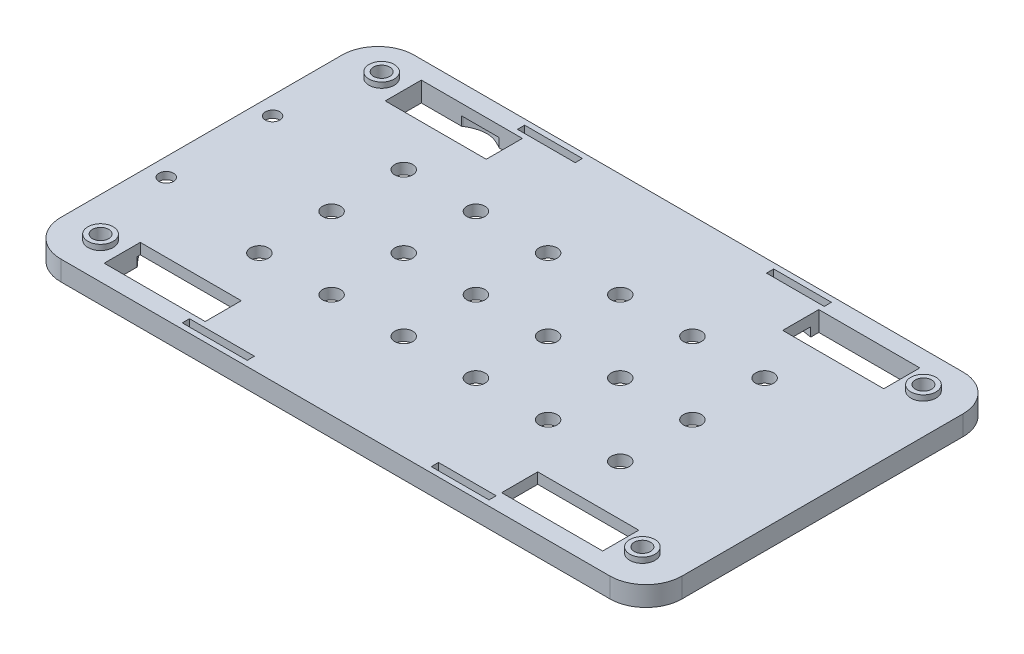
from build123d import *

# Parameters (mm, degrees)
BOSS_EXTRUDE2_DEPTH     = 6.5
CUT_EXTRUDE1_DEPTH      = 2.5
SKETCH7_W               = 15.126318285
SKETCH7_H               = 50.045217971
CUT_EXTRUDE2_DEPTH      = 2.5
SKETCH9_R               = 4.5
CUT_EXTRUDE5_DEPTH      = 3.5
SKETCH10_R              = 2.25
CUT_EXTRUDE6_DEPTH      = 21
SKETCH8_W               = 28
SKETCH8_H               = 10
CUT_EXTRUDE8_DEPTH      = 42
SKETCH8_3_W             = 12
SKETCH8_3_H             = 10
SKETCH8_3_R             = 3.5
CUT_EXTRUDE9_DEPTH      = 1
MIRROR2_COPY_1_SKETCH_R = 4.5
MIRROR2_COPY_1_DEPTH    = 3.5
MIRROR2_COPY_2_SKETCH_R = 2.25
MIRROR2_COPY_2_DEPTH    = 21
MIRROR2_COPY_3_SKETCH_W = 28
MIRROR2_COPY_3_SKETCH_H = 10
MIRROR2_COPY_3_DEPTH    = 42
MIRROR2_COPY_4_SKETCH_W = 12
MIRROR2_COPY_4_SKETCH_H = 10
MIRROR2_COPY_4_SKETCH_R = 3.5
MIRROR2_COPY_4_DEPTH    = 1
SKETCH13_W              = 122.138782423
SKETCH13_H              = 57.881417702
CUT_EXTRUDE10_DEPTH     = 1
SKETCH14_R              = 2.5
CUT_EXTRUDE11_DEPTH     = 57
SKETCH16_W              = 16
SKETCH16_H              = 2
SKETCH16_W_2            = 18
CUT_EXTRUDE12_DEPTH     = 57
SKETCH17_W              = 198.020150231
SKETCH17_H              = 122.239022266
CUT_EXTRUDE14_DEPTH     = 48.5
SKETCH23_R              = 2
CUT_EXTRUDE15_DEPTH     = 48.5
SKETCH23_3_R            = 4.25
SKETCH23_3_R_2          = 2
CUT_EXTRUDE16_DEPTH     = 1
SKETCH25_R              = 3.5
SKETCH25_R_2            = 2.25
BOSS_EXTRUDE3_DEPTH     = 1.5


with BuildPart() as part:
    # Sketch6 → Boss-Extrude2 (new body)
    with BuildSketch(Plane(origin=(0, 0, 0), x_dir=(1, 0, 0), z_dir=(0, 1, 0))):
        with BuildLine():
            Line((73.981646775, 59.583909473), (-78.157135648, 59.583909473))
            ThreePointArc((-78.157135648, 59.583909473), (-85.22820346, 56.654977285), (-88.157135648, 49.583909473))
            Line((-88.157135648, 49.583909473), (-88.157135648, -28.297508229))
            ThreePointArc((-88.157135648, -28.297508229), (-85.22820346, -35.368576041), (-78.157135648, -38.297508229))
            Line((-78.157135648, -38.297508229), (73.981646775, -38.297508229))
            ThreePointArc((73.981646775, -38.297508229), (81.052714587, -35.368576041), (83.981646775, -28.297508229))
            Line((83.981646775, -28.297508229), (83.981646775, 49.583909473))
            ThreePointArc((83.981646775, 49.583909473), (81.052714587, 56.654977285), (73.981646775, 59.583909473))
        make_face()
    extrude(amount=BOSS_EXTRUDE2_DEPTH)

    # Sketch1 → Cut-Extrude1 (cut)
    with BuildSketch(Plane(origin=(0, 0, 0), x_dir=(1, 0, 0), z_dir=(0, 1, 0))):
        with BuildLine():
            Line((77.806365081, -0.96565382), (-77.157134057, -0.96565382))
            Line((-77.157134057, -0.96565382), (-77.157133487, -14.112200011))
            add(Edge.make_bspline(
                [(-77.157133487, -14.112200011), (-77.156536942, -14.370123486), (-77.109197781, -14.873209632), (-76.835922488, -15.955912897), (-76.187889009, -17.500769448), (-75.043983016, -19.418277882), (-73.152039277, -22.009216703), (-70.349522729, -25.082160357), (-66.873619377, -28.097169115), (-63.686430755, -30.214139025), (-61.001852204, -31.406236435), (-58.827378352, -31.848010778), (-57.571800044, -31.879365283), (-56.919048161, -31.916770504)],
                knots=[0.000484301, 0.000484301, 0.000484301, 0.000484301, 0.031521334, 0.062558366, 0.124632431, 0.186706496, 0.248780561, 0.37292869, 0.49707682, 0.62122495, 0.745373079, 0.869521209, 0.993669339, 0.993669339, 0.993669339, 0.993669339], degree=3))
            add(Edge.make_bspline(
                [(-56.919048161, -31.916770504), (-56.676855651, -31.887329504), (-56.202107187, -31.827411173), (-55.17909933, -31.687000892), (-53.829380758, -31.487736495), (-52.075898695, -31.218386946), (-49.57440565, -30.835368063), (-46.14645809, -30.337211074), (-41.582465958, -29.781294531), (-36.59758114, -29.326101352), (-29.427370913, -28.913030471), (-19.557102597, -28.846779859), (-6.483877393, -29.587535165), (5.244808229, -30.786505775), (15.023020088, -31.929485511), (22.521025078, -32.809036887), (30.153844065, -33.641998773), (35.340846207, -34.107490241), (37.926285135, -34.298975741)],
                knots=[0.000538145, 0.000538145, 0.000538145, 0.000538145, 0.016151963, 0.031765781, 0.062993416, 0.094221052, 0.125448688, 0.18790396, 0.250359232, 0.312814503, 0.375269775, 0.500180319, 0.625090862, 0.750001406, 0.812456678, 0.874911949, 0.937367221, 0.999822493, 0.999822493, 0.999822493, 0.999822493], degree=3))
            ThreePointArc((37.926285135, -34.298975741), (38.702526051, -34.294429262), (39.475271872, -34.220710033))
            add(Edge.make_bspline(
                [(39.475271872, -34.220710033), (41.007855914, -34.057436076), (44.089984585, -33.714701696), (50.083540013, -32.842915348), (57.096899249, -31.185924421), (64.218389099, -27.883874428), (69.776327895, -23.185685517), (73.049743993, -18.278857828), (74.917700916, -14.026885359), (75.980532113, -10.773207259), (76.750872111, -7.572378035), (77.199527425, -5.064024493), (77.479780782, -3.227934), (77.653952405, -2.012317888), (77.758523252, -1.282417326), (77.806365081, -0.96565382)],
                knots=[-0.000308659, -0.000308659, -0.000308659, -0.000308659, 0.063093373, 0.126495404, 0.253299468, 0.380103532, 0.506907596, 0.633711659, 0.697113691, 0.760515723, 0.823917755, 0.887319787, 0.919020803, 0.950721818, 0.978851886, 0.978851886, 0.978851886, 0.978851886], degree=3))
        make_face()
        with BuildLine():
            Line((-77.157135648, 35.76464303), (-77.157134057, -0.96565382))
            Line((-77.157134057, -0.96565382), (77.806365081, -0.96565382))
            add(Edge.make_bspline(
                [(77.806365081, -0.96565382), (77.812438323, -0.925442533), (77.87221605, -0.53245946), (77.930059012, -0.183407073), (77.984899751, 0.147711222)],
                knots=[0.978851886, 0.978851886, 0.978851886, 0.978851886, 0.982422834, 1.01412385, 1.01412385, 1.01412385, 1.01412385], degree=3))
            add(Edge.make_bspline(
                [(77.984899751, 0.147711222), (78.028632075, 1.263321996), (78.063685274, 3.522430751), (77.942610131, 6.756968322), (77.659550444, 9.90467033), (77.073307047, 13.967118446), (75.962568899, 18.783585703), (73.443316656, 25.935742417), (69.020568834, 33.80984715), (62.049489108, 41.493231365), (53.789484117, 47.344418041), (44.612113932, 51.294661515), (34.903628635, 53.280392725), (28.311253849, 53.235690332), (25.060177828, 52.873239487)],
                knots=[0.000169226, 0.000169226, 0.000169226, 0.000169226, 0.031413574, 0.062657922, 0.09390227, 0.125146618, 0.187635314, 0.25012401, 0.375101401, 0.500078793, 0.625056185, 0.750033577, 0.875010969, 0.999988361, 0.999988361, 0.999988361, 0.999988361], degree=3))
            add(Edge.make_bspline(
                [(25.060177828, 52.873239487), (19.895446944, 51.629390577), (12.322434608, 49.13169364), (2.160698602, 45.971278142), (-3.037110446, 44.691336857), (-5.659268145, 44.190364293)],
                knots=[0.000658959, 0.000658959, 0.000658959, 0.000658959, 0.498067368, 0.746771573, 0.995475778, 0.995475778, 0.995475778, 0.995475778], degree=3))
            add(Edge.make_bspline(
                [(-5.659268145, 44.190364293), (-6.687899132, 44.046149587), (-8.728734339, 43.771857825), (-12.963271971, 43.266800577), (-18.182613839, 42.795189919), (-23.901458121, 42.63215561), (-28.830638135, 42.989857068), (-32.966568973, 43.951399156), (-35.917714049, 45.291439085), (-38.19591431, 46.677930402), (-39.939161114, 47.865789175), (-41.506959745, 48.979842665), (-42.863802202, 49.929184347), (-43.616290768, 50.440510486), (-43.98532936, 50.688555671)],
                knots=[-0.00019559, -0.00019559, -0.00019559, -0.00019559, 0.062587211, 0.125370012, 0.250935613, 0.376501215, 0.502066816, 0.627632417, 0.753198019, 0.81598082, 0.87876362, 0.941546421, 0.972937821, 1.004329222, 1.004329222, 1.004329222, 1.004329222], degree=3))
            add(Edge.make_bspline(
                [(-43.98532936, 50.688555671), (-44.244485854, 50.867312015), (-44.768150418, 51.232519494), (-45.750657054, 51.933111662), (-46.891239492, 52.75905139), (-48.145972585, 53.649626958), (-49.697116091, 54.681113287), (-51.460780236, 55.648746777), (-53.407719169, 56.259273829), (-55.251731489, 56.357375065), (-56.710973324, 56.08081223), (-57.794758617, 55.713765742), (-58.546542767, 55.391458897), (-59.229896481, 55.042763399), (-59.583745645, 54.835934013), (-59.770155285, 54.723823826)],
                knots=[-0.002497219, -0.002497219, -0.002497219, -0.002497219, 0.029065652, 0.060628523, 0.123754265, 0.186880007, 0.250005749, 0.376257234, 0.502508718, 0.628760202, 0.755011687, 0.818137429, 0.881263171, 0.944388913, 1.007514655, 1.007514655, 1.007514655, 1.007514655], degree=3))
            add(Edge.make_bspline(
                [(-59.770155285, 54.723823826), (-60.193626174, 54.476092852), (-61.03864602, 53.961192652), (-62.636768194, 52.907176262), (-65.258656407, 50.976312285), (-68.51709364, 48.049765778), (-71.244275363, 45.065662035), (-73.189921829, 42.724657875), (-74.069794154, 41.617885903), (-74.515784144, 41.052117052)],
                knots=[0.000174078, 0.000174078, 0.000174078, 0.000174078, 0.062881444, 0.12558881, 0.251003541, 0.501833004, 0.752662466, 0.878077198, 1.003491929, 1.003491929, 1.003491929, 1.003491929], degree=3))
            add(Edge.make_bspline(
                [(-74.515784144, 41.052117052), (-75.065753244, 40.22169422), (-76.07645723, 38.477870595), (-76.833603448, 36.687528936), (-77.157135648, 35.76464303)],
                knots=[0.499549048, 0.499549048, 0.499549048, 0.499549048, 0.499765799, 0.49998255, 0.49998255, 0.49998255, 0.49998255], degree=3))
        make_face()
    extrude(amount=CUT_EXTRUDE1_DEPTH, mode=Mode.SUBTRACT)

    # Sketch7 → Cut-Extrude2 (cut)
    with BuildSketch(Plane.XZ):
        with Locations((-83.782077592, -10.91040897)):
            Rectangle(SKETCH7_W, SKETCH7_H)
    extrude(amount=-CUT_EXTRUDE2_DEPTH, mode=Mode.SUBTRACT)

    # Sketch9 → Cut-Extrude5 (cut)
    with BuildSketch(Plane.XZ):
        with Locations(Location((72.981646775, -49.583909473, 0), (0, 0, 270))):
            Circle(SKETCH9_R)
    cut_extrude5 = extrude(amount=-CUT_EXTRUDE5_DEPTH, mode=Mode.SUBTRACT)

    # Sketch10 → Cut-Extrude6 (cut)
    with BuildSketch(Plane.XZ.offset(-3.5)):
        with Locations(Location((72.981646775, -49.583909473, 0), (0, 0, 270))):
            Circle(SKETCH10_R)
    cut_extrude6 = extrude(amount=-CUT_EXTRUDE6_DEPTH, mode=Mode.SUBTRACT)

    # Sketch8 → Cut-Extrude8 (cut)
    with BuildSketch(Plane(origin=(0, 6.5, 0), x_dir=(1, 0, 0), z_dir=(0, 1, 0))):
        with Locations((52.981646775, 49.583909473)):
            Rectangle(SKETCH8_W, SKETCH8_H)
    cut_extrude8 = extrude(amount=-CUT_EXTRUDE8_DEPTH, mode=Mode.SUBTRACT)

    # Sketch8<3> → Cut-Extrude9 (cut)
    with BuildSketch(Plane(origin=(0, 6.5, 0), x_dir=(1, 0, 0), z_dir=(0, 1, 0))):
        with Locations((72.981646775, 49.583909473)):
            Rectangle(SKETCH8_3_W, SKETCH8_3_H)
        with Locations(Location((72.981646775, 49.583909473, 0), (0, 0, 270))):
            Circle(SKETCH8_3_R, mode=Mode.SUBTRACT)
    cut_extrude9 = extrude(amount=-CUT_EXTRUDE9_DEPTH, mode=Mode.SUBTRACT)

    # Mirror1: Cut-Extrude5, Cut-Extrude6, Cut-Extrude8, Cut-Extrude9 across plane
    add(cut_extrude5.mirror(Plane.XY.offset(-10.643200622)), mode=Mode.SUBTRACT)
    add(cut_extrude6.mirror(Plane.XY.offset(-10.643200622)), mode=Mode.SUBTRACT)
    add(cut_extrude8.mirror(Plane.XY.offset(-10.643200622)), mode=Mode.SUBTRACT)
    add(cut_extrude9.mirror(Plane.XY.offset(-10.643200622)), mode=Mode.SUBTRACT)

    # Mirror2: Cut-Extrude5, Cut-Extrude6, Cut-Extrude8, Cut-Extrude9 across plane
    add(cut_extrude5.mirror(Plane.ZY.offset(2.087744437)), mode=Mode.SUBTRACT)
    add(cut_extrude6.mirror(Plane.ZY.offset(2.087744437)), mode=Mode.SUBTRACT)
    add(cut_extrude8.mirror(Plane.ZY.offset(2.087744437)), mode=Mode.SUBTRACT)
    add(cut_extrude9.mirror(Plane.ZY.offset(2.087744437)), mode=Mode.SUBTRACT)

    # Mirror2 copy 1 sketch → Mirror2 copy 1 (cut)
    with BuildSketch(Plane(origin=(-4.175488873, 0, -21.286401244), x_dir=(-1, 0, 0), z_dir=(0, -1, 0))):
        with Locations(Location((72.981646775, -49.583909473, 0), (0, 0, 270))):
            Circle(MIRROR2_COPY_1_SKETCH_R)
    extrude(amount=-MIRROR2_COPY_1_DEPTH, mode=Mode.SUBTRACT)

    # Mirror2 copy 2 sketch → Mirror2 copy 2 (cut)
    with BuildSketch(Plane(origin=(-4.175488873, 3.5, -21.286401244), x_dir=(-1, 0, 0), z_dir=(0, -1, 0))):
        with Locations(Location((72.981646775, -49.583909473, 0), (0, 0, 270))):
            Circle(MIRROR2_COPY_2_SKETCH_R)
    extrude(amount=-MIRROR2_COPY_2_DEPTH, mode=Mode.SUBTRACT)

    # Mirror2 copy 3 sketch → Mirror2 copy 3 (cut)
    with BuildSketch(Plane(origin=(-4.175488873, 6.5, -21.286401244), x_dir=(-1, 0, 0), z_dir=(0, 1, 0))):
        with Locations((52.981646775, 49.583909473)):
            Rectangle(MIRROR2_COPY_3_SKETCH_W, MIRROR2_COPY_3_SKETCH_H)
    extrude(amount=-MIRROR2_COPY_3_DEPTH, mode=Mode.SUBTRACT)

    # Mirror2 copy 4 sketch → Mirror2 copy 4 (cut)
    with BuildSketch(Plane(origin=(-4.175488873, 6.5, -21.286401244), x_dir=(-1, 0, 0), z_dir=(0, 1, 0))):
        with Locations((72.981646775, 49.583909473)):
            Rectangle(MIRROR2_COPY_4_SKETCH_W, MIRROR2_COPY_4_SKETCH_H)
        with Locations(Location((72.981646775, 49.583909473, 0), (0, 0, 270))):
            Circle(MIRROR2_COPY_4_SKETCH_R, mode=Mode.SUBTRACT)
    extrude(amount=-MIRROR2_COPY_4_DEPTH, mode=Mode.SUBTRACT)

    # Sketch13 → Cut-Extrude10 (cut)
    with BuildSketch(Plane(origin=(0, 6.5, 0), x_dir=(1, 0, 0), z_dir=(0, 1, 0))):
        with Locations((-2.087744436, 10.643200622)):
            Rectangle(SKETCH13_W, SKETCH13_H)
    extrude(amount=-CUT_EXTRUDE10_DEPTH, mode=Mode.SUBTRACT)

    # Sketch14 → Cut-Extrude11 (cut)
    with BuildSketch(Plane(origin=(0, 5.5, 0), x_dir=(1, 0, 0), z_dir=(0, 1, 0))):
        with Locations(Location((-52.087744437, 30.643200622, 0), (0, 0, 270))):
            Circle(SKETCH14_R)
        with Locations(Location((7.912255563, 30.643200622, 0), (0, 0, 270))):
            Circle(SKETCH14_R)
        with Locations(Location((27.912255563, 30.643200622, 0), (0, 0, 270))):
            Circle(SKETCH14_R)
        with Locations(Location((47.912255563, 30.643200622, 0), (0, 0, 270))):
            Circle(SKETCH14_R)
        with Locations(Location((47.912255563, 10.643200622, 0), (0, 0, 270))):
            Circle(SKETCH14_R)
        with Locations(Location((7.912255563, 10.643200622, 0), (0, 0, 270))):
            Circle(SKETCH14_R)
        with Locations(Location((-12.087744437, 10.643200622, 0), (0, 0, 270))):
            Circle(SKETCH14_R)
        with Locations(Location((-32.087744437, 10.643200622, 0), (0, 0, 270))):
            Circle(SKETCH14_R)
        with Locations(Location((-52.087744437, 10.643200622, 0), (0, 0, 270))):
            Circle(SKETCH14_R)
        with Locations(Location((47.912255563, -9.356799378, 0), (0, 0, 270))):
            Circle(SKETCH14_R)
        with Locations(Location((27.912255563, -9.356799378, 0), (0, 0, 270))):
            Circle(SKETCH14_R)
        with Locations(Location((7.912255563, -9.356799378, 0), (0, 0, 270))):
            Circle(SKETCH14_R)
        with Locations(Location((-12.087744437, -9.356799378, 0), (0, 0, 270))):
            Circle(SKETCH14_R)
        with Locations(Location((-32.087744437, -9.356799378, 0), (0, 0, 270))):
            Circle(SKETCH14_R)
        with Locations(Location((-52.087744437, -9.356799378, 0), (0, 0, 270))):
            Circle(SKETCH14_R)
        with Locations(Location((-32.087744437, 30.643200622, 0), (0, 0, 270))):
            Circle(SKETCH14_R)
        with Locations(Location((-12.087744437, 30.643200622, 0), (0, 0, 270))):
            Circle(SKETCH14_R)
        with Locations(Location((27.912255563, 10.643200622, 0), (0, 0, 270))):
            Circle(SKETCH14_R)
    extrude(amount=-CUT_EXTRUDE11_DEPTH, mode=Mode.SUBTRACT)

    # Sketch16 → Cut-Extrude12 (cut)
    with BuildSketch(Plane.XZ):
        with Locations((30.981646775, -57.083909473)):
            Rectangle(SKETCH16_W, SKETCH16_H)
        with Locations((30.981646775, 35.797508229)):
            Rectangle(SKETCH16_W, SKETCH16_H)
        with Locations((-38.018353225, -57.083909473)):
            Rectangle(SKETCH16_W, SKETCH16_H)
        with Locations((-37.018353225, 35.797508229)):
            Rectangle(SKETCH16_W_2, SKETCH16_H)
    extrude(amount=-CUT_EXTRUDE12_DEPTH, mode=Mode.SUBTRACT)

    # Sketch17 → Cut-Extrude14 (cut)
    with BuildSketch(Plane(origin=(0, 5.5, 0), x_dir=(1, 0, 0), z_dir=(0, 1, 0))):
        with Locations((-0.586253557, 7.90518784)):
            Rectangle(SKETCH17_W, SKETCH17_H)
    extrude(amount=CUT_EXTRUDE14_DEPTH, mode=Mode.SUBTRACT)

    # Sketch23 → Cut-Extrude15 (cut)
    with BuildSketch(Plane.XZ.offset(-2.5)):
        with Locations(Location((-83.157135648, 4.08959103, 0), (0, 0, 270))):
            Circle(SKETCH23_R)
    cut_extrude15 = extrude(amount=-CUT_EXTRUDE15_DEPTH, mode=Mode.SUBTRACT)

    # Sketch23<3> → Cut-Extrude16 (cut)
    with BuildSketch(Plane.XZ.offset(-2.5)):
        with Locations(Location((-83.157135648, 4.08959103, 0), (0, 0, 270))):
            Circle(SKETCH23_3_R)
        with Locations(Location((-83.157135648, 4.08959103, 0), (0, 0, 270))):
            Circle(SKETCH23_3_R_2, mode=Mode.SUBTRACT)
    cut_extrude16 = extrude(amount=-CUT_EXTRUDE16_DEPTH, mode=Mode.SUBTRACT)

    # Mirror4: Cut-Extrude15, Cut-Extrude16 across plane
    add(cut_extrude15.mirror(Plane.XY.offset(-10.643200622)), mode=Mode.SUBTRACT)
    add(cut_extrude16.mirror(Plane.XY.offset(-10.643200622)), mode=Mode.SUBTRACT)

    # Sketch25 → Boss-Extrude3 (add)
    # profile 1 of 4: a face of its own
    with BuildSketch(Plane(origin=(0, 5.5, 0), x_dir=(1, 0, 0), z_dir=(0, 1, 0))):
        with Locations(Location((72.981646775, 49.583909473, 0), (0, 0, 270))):
            Circle(SKETCH25_R)
        with Locations(Location((72.981646775, 49.583909473, 0), (0, 0, 90))):
            Circle(SKETCH25_R_2, mode=Mode.SUBTRACT)
    # profile 2 of 4: a face of its own
    with BuildSketch(Plane(origin=(0, 5.5, 0), x_dir=(1, 0, 0), z_dir=(0, 1, 0))):
        with Locations(Location((72.981646775, -28.297508229, 0), (0, 0, 270))):
            Circle(SKETCH25_R)
        with Locations(Location((72.981646775, -28.297508229, 0), (0, 0, 270))):
            Circle(SKETCH25_R_2, mode=Mode.SUBTRACT)
    # profile 3 of 4: a face of its own
    with BuildSketch(Plane(origin=(0, 5.5, 0), x_dir=(1, 0, 0), z_dir=(0, 1, 0))):
        with Locations(Location((-77.157135648, 49.583909473, 0), (0, 0, 270))):
            Circle(SKETCH25_R)
        with Locations(Location((-77.157135648, 49.583909473, 0), (0, 0, 90))):
            Circle(SKETCH25_R_2, mode=Mode.SUBTRACT)
    # profile 4 of 4: a face of its own
    with BuildSketch(Plane(origin=(0, 5.5, 0), x_dir=(1, 0, 0), z_dir=(0, 1, 0))):
        with Locations(Location((-77.157135648, -28.297508229, 0), (0, 0, 270))):
            Circle(SKETCH25_R)
        with Locations(Location((-77.157135648, -28.297508229, 0), (0, 0, 270))):
            Circle(SKETCH25_R_2, mode=Mode.SUBTRACT)
    extrude(amount=BOSS_EXTRUDE3_DEPTH)


solid = part.part
